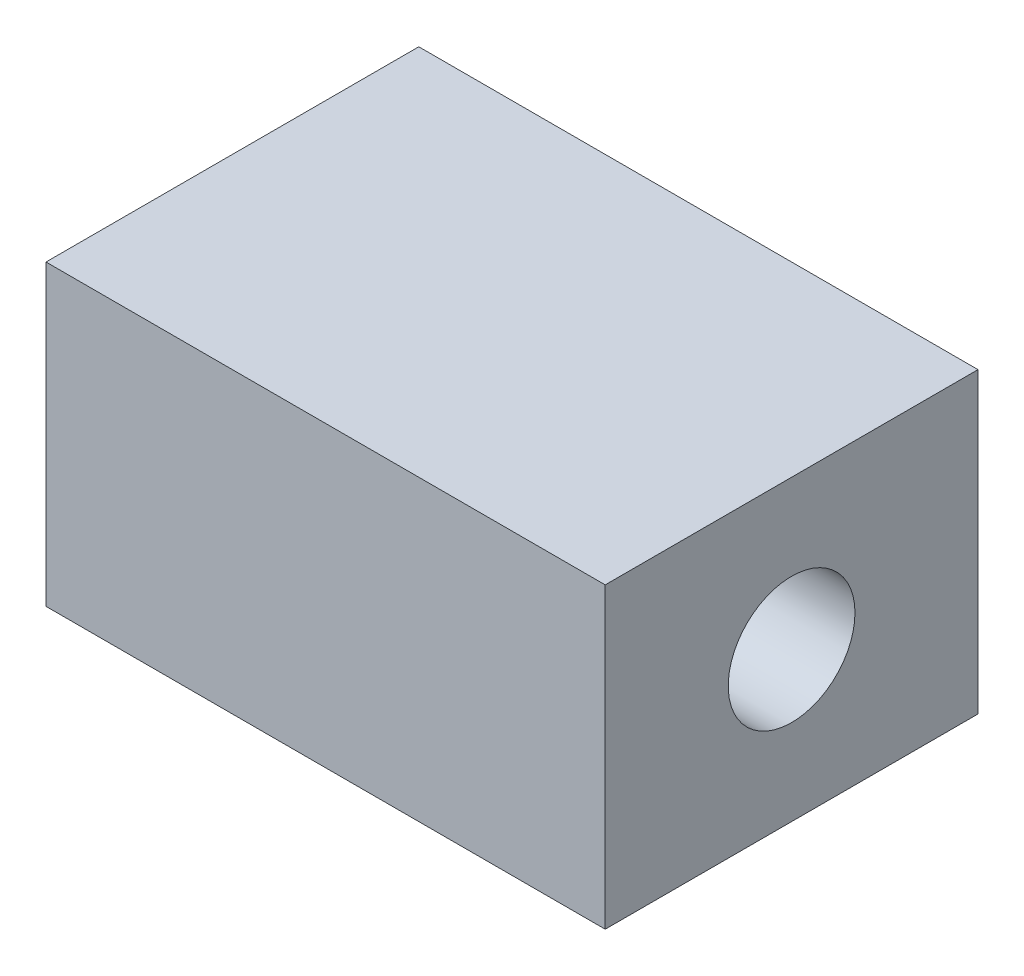
from build123d import *

# Parameters (mm, degrees)
SKETCH2_W               = 30
SKETCH2_H               = 20
BOSS_EXTRUDE1_DEPTH     = 8
CUT_EXTRUDE1_DEPTH      = 20.723082923
CUT_EXTRUDE1_DEPTH_BACK = 20.723082923
SKETCH5_R               = 3.4


with BuildPart() as part:
    # Sketch2 → Boss-Extrude1 (new, symmetric)
    with BuildSketch(Plane(origin=(0, 0, 0), x_dir=(1, 0, 0), z_dir=(0, 1, 0))):
        Rectangle(SKETCH2_W, SKETCH2_H)
    extrude(amount=BOSS_EXTRUDE1_DEPTH, both=True)

    # Sketch5 → Cut-Extrude1 (cut, two sides: drawn at the far end of the back side and taken through both)
    with BuildSketch(Plane(origin=(0, 0, 0), x_dir=(0, 0, -1), z_dir=(1, 0, 0)).offset(-CUT_EXTRUDE1_DEPTH_BACK)):
        Circle(SKETCH5_R)
    extrude(amount=CUT_EXTRUDE1_DEPTH + CUT_EXTRUDE1_DEPTH_BACK, mode=Mode.SUBTRACT)


solid = part.part
